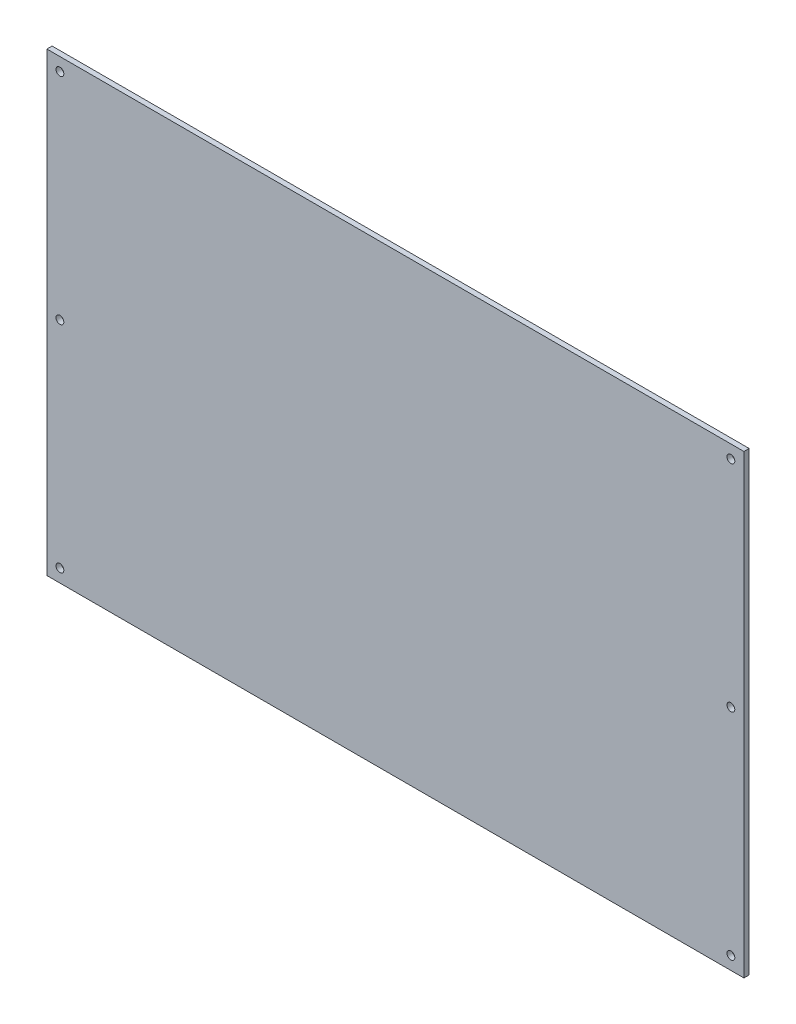
from build123d import *

# Parameters (mm, degrees)
SKICA1_W                = 535
SKICA1_H                = 350
SKICA1_R                = 3
P_IDAT_VYSUNUT_M1_DEPTH = 4


with BuildPart() as part:
    # Skica1 → Přidat vysunutím1 (new body)
    with BuildSketch(Plane.XY):
        Rectangle(SKICA1_W, SKICA1_H)
        with Locations((-257.5, 165)):
            Circle(SKICA1_R, mode=Mode.SUBTRACT)
        with Locations((-257.5, 0)):
            Circle(SKICA1_R, mode=Mode.SUBTRACT)
        with Locations((-257.5, -165)):
            Circle(SKICA1_R, mode=Mode.SUBTRACT)
        with Locations((257.5, 165)):
            Circle(SKICA1_R, mode=Mode.SUBTRACT)
        with Locations((257.5, 0)):
            Circle(SKICA1_R, mode=Mode.SUBTRACT)
        with Locations((257.5, -165)):
            Circle(SKICA1_R, mode=Mode.SUBTRACT)
    extrude(amount=P_IDAT_VYSUNUT_M1_DEPTH)


solid = part.part
